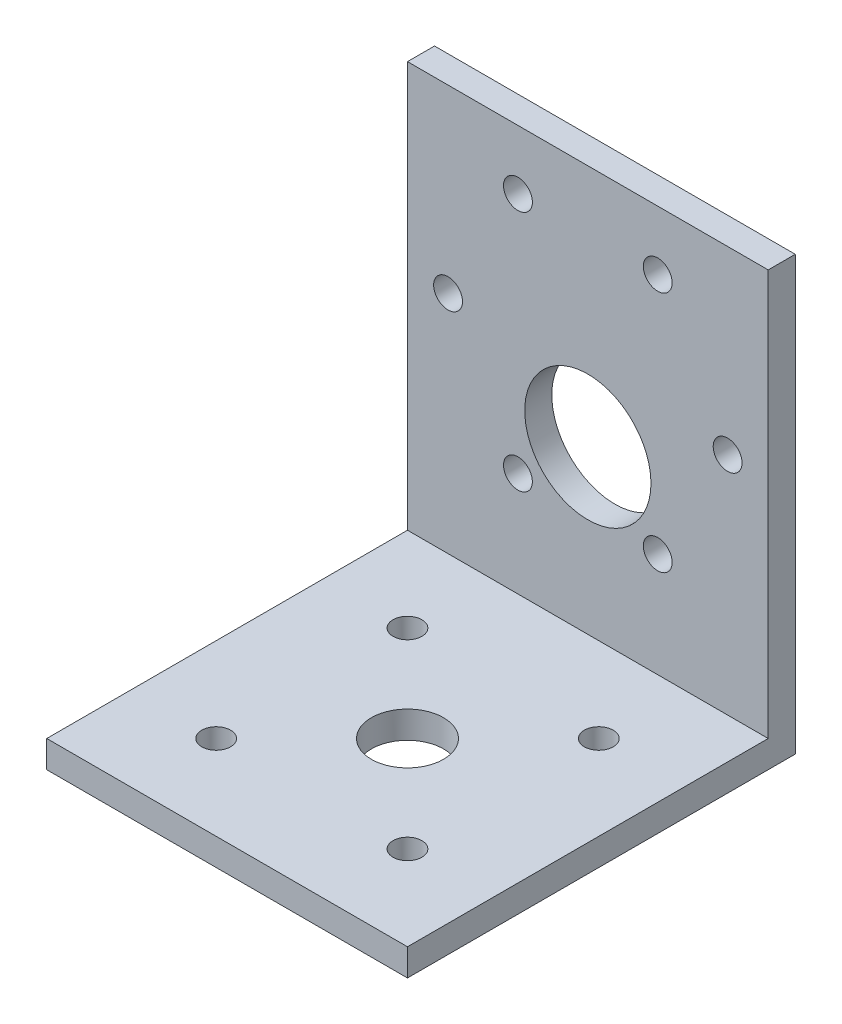
from build123d import *

# Parameters (mm, degrees)
SKETCH2_W               = 40
SKETCH2_H               = 45
SKETCH2_R               = 1.6
SKETCH2_R_2             = 7
BOSS_EXTRUDE1_DEPTH     = 3
SKETCH3_W               = 43
SKETCH3_H               = 3
BOSS_EXTRUDE2_DEPTH     = 40
CUT_EXTRUDE1_DEPTH      = 74.986485252
CUT_EXTRUDE1_DEPTH_BACK = 74.986485252
SKETCH4_R               = 1.6
SKETCH4_R_2             = 4


with BuildPart() as part:
    # Sketch2 → Boss-Extrude1 (new body)
    with BuildSketch(Plane.XY):
        with Locations((20, -22.5)):
            Rectangle(SKETCH2_W, SKETCH2_H)
        with Locations((4.5, -20)):
            Circle(SKETCH2_R, mode=Mode.SUBTRACT)
        with Locations(Location((35.5, -20, 0), (0, 0, 180))):
            Circle(SKETCH2_R, mode=Mode.SUBTRACT)
        with Locations((12.25, -6.576606241)):
            Circle(SKETCH2_R, mode=Mode.SUBTRACT)
        with Locations(Location((27.75, -6.576606241, 0), (0, 0, 180))):
            Circle(SKETCH2_R, mode=Mode.SUBTRACT)
        with Locations((27.75, -33.423393759)):
            Circle(SKETCH2_R, mode=Mode.SUBTRACT)
        with Locations(Location((12.25, -33.423393759, 0), (0, 0, 180))):
            Circle(SKETCH2_R, mode=Mode.SUBTRACT)
        with Locations((20, -27)):
            Circle(SKETCH2_R_2, mode=Mode.SUBTRACT)
    extrude(amount=BOSS_EXTRUDE1_DEPTH)

    # Sketch3 → Boss-Extrude2 (add)
    with BuildSketch(Plane(origin=(0, 0, 0), x_dir=(0, 0, -1), z_dir=(1, 0, 0))):
        with Locations((-21.5, -46.5)):
            Rectangle(SKETCH3_W, SKETCH3_H)
    extrude(amount=BOSS_EXTRUDE2_DEPTH)

    # Sketch4 → Cut-Extrude1 (cut, two sides: drawn at the far end of the back side and taken through both)
    with BuildSketch(Plane(origin=(0, -45, 0), x_dir=(1, 0, 0), z_dir=(0, 1, 0)).offset(-CUT_EXTRUDE1_DEPTH_BACK)):
        with Locations(Location((9.393398282, -33.606601718, 0), (0, 0, 270))):
            Circle(SKETCH4_R)
        with Locations(Location((20, -23, 0), (0, 0, 270))):
            Circle(SKETCH4_R_2)
        with Locations(Location((9.393398282, -12.393398282, 0), (0, 0, 270))):
            Circle(SKETCH4_R)
        with Locations(Location((30.606601718, -12.393398282, 0), (0, 0, 270))):
            Circle(SKETCH4_R)
        with Locations(Location((30.606601718, -33.606601718, 0), (0, 0, 270))):
            Circle(SKETCH4_R)
    extrude(amount=CUT_EXTRUDE1_DEPTH + CUT_EXTRUDE1_DEPTH_BACK, mode=Mode.SUBTRACT)


solid = part.part
